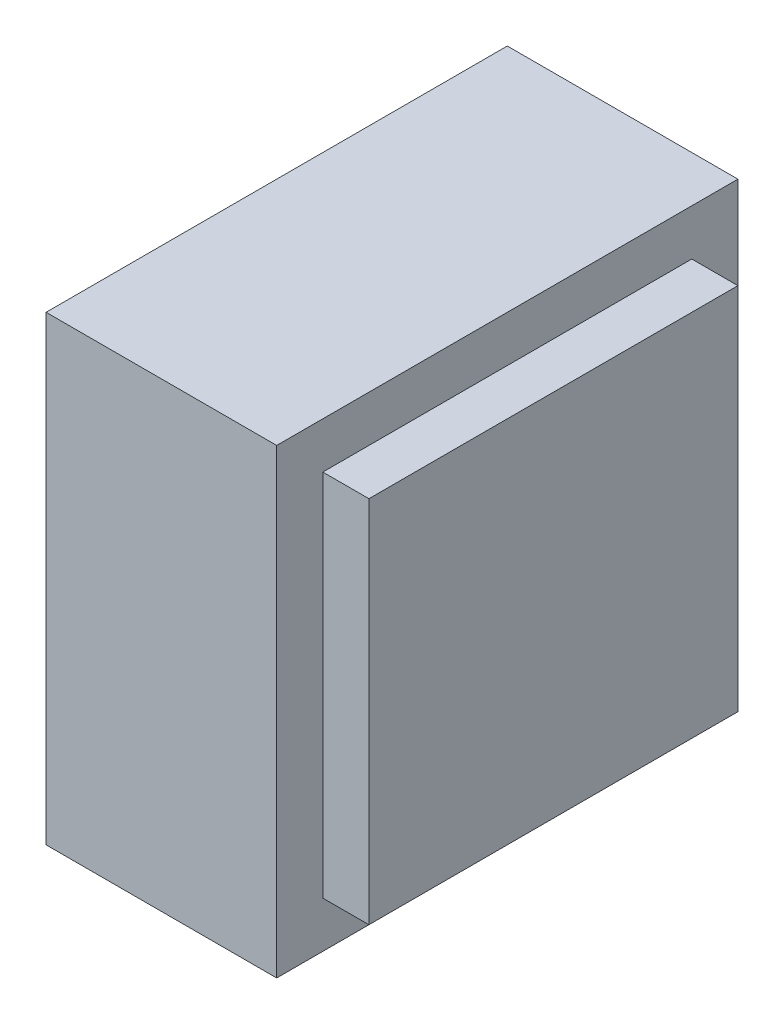
from build123d import *

# Parameters (mm, degrees)
SKETCH1_W           = 2
SKETCH1_H           = 2
BOSS_EXTRUDE1_DEPTH = 1
SKETCH2_W           = 1.6
SKETCH2_H           = 1.6
BOSS_EXTRUDE2_DEPTH = 0.2


with BuildPart() as part:
    # Sketch1 → Boss-Extrude1 (new body)
    with BuildSketch(Plane(origin=(0, 0, 0), x_dir=(0, 0, -1), z_dir=(1, 0, 0))):
        Rectangle(SKETCH1_W, SKETCH1_H)
    extrude(amount=BOSS_EXTRUDE1_DEPTH)

    # Sketch2 → Boss-Extrude2 (add)
    with BuildSketch(Plane(origin=(1, 0, 0), x_dir=(0, 0, -1), z_dir=(1, 0, 0))):
        Rectangle(SKETCH2_W, SKETCH2_H)
    extrude(amount=BOSS_EXTRUDE2_DEPTH)


solid = part.part
